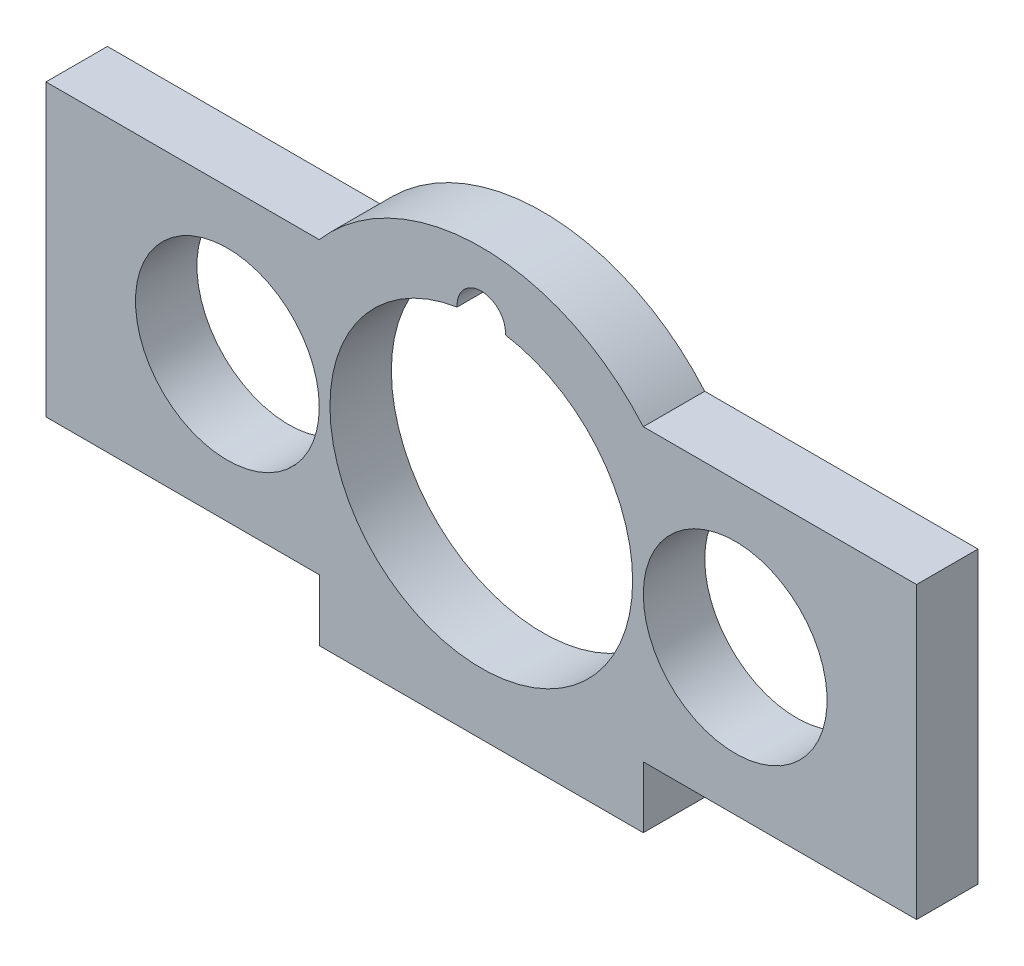
from build123d import *

# Parameters (mm, degrees)
SKETCH1_R  = 3.8
BASE_DEPTH = 2.54


with BuildPart() as part:
    # Sketch1 → Base (new body)
    with BuildSketch(Plane.XY):
        with BuildLine():
            Line((-18, -6.258565559), (-18, 5.741434441))
            Line((-18, 5.741434441), (-6.7, 5.741434441))
            ThreePointArc((-6.7, 5.741434441), (0, 8.823495307), (6.7, 5.741434441))
            Line((6.7, 5.741434441), (18, 5.741434441))
            Line((18, 5.741434441), (18, -6.258565559))
            Line((18, -6.258565559), (6.7, -6.258565559))
            Line((6.7, -6.258565559), (6.7, -8.798565559))
            Line((6.7, -8.798565559), (-6.7, -8.798565559))
            Line((-6.7, -8.798565559), (-6.7, -6.258565559))
            Line((-6.7, -6.258565559), (-18, -6.258565559))
        make_face()
        with Locations((-10.5, -0.258565559)):
            Circle(SKETCH1_R, mode=Mode.SUBTRACT)
        with Locations(Location((10.5, -0.258565559, 0), (0, 0, 180))):
            Circle(SKETCH1_R, mode=Mode.SUBTRACT)
        with BuildLine():
            ThreePointArc((0.997445717, 6.178571429), (0, -6.258565559), (-0.997445717, 6.178571429))
            ThreePointArc((-0.997445717, 6.178571429), (0, 7.25), (0.997445717, 6.178571429))
        make_face(mode=Mode.SUBTRACT)
    extrude(amount=BASE_DEPTH)


solid = part.part
